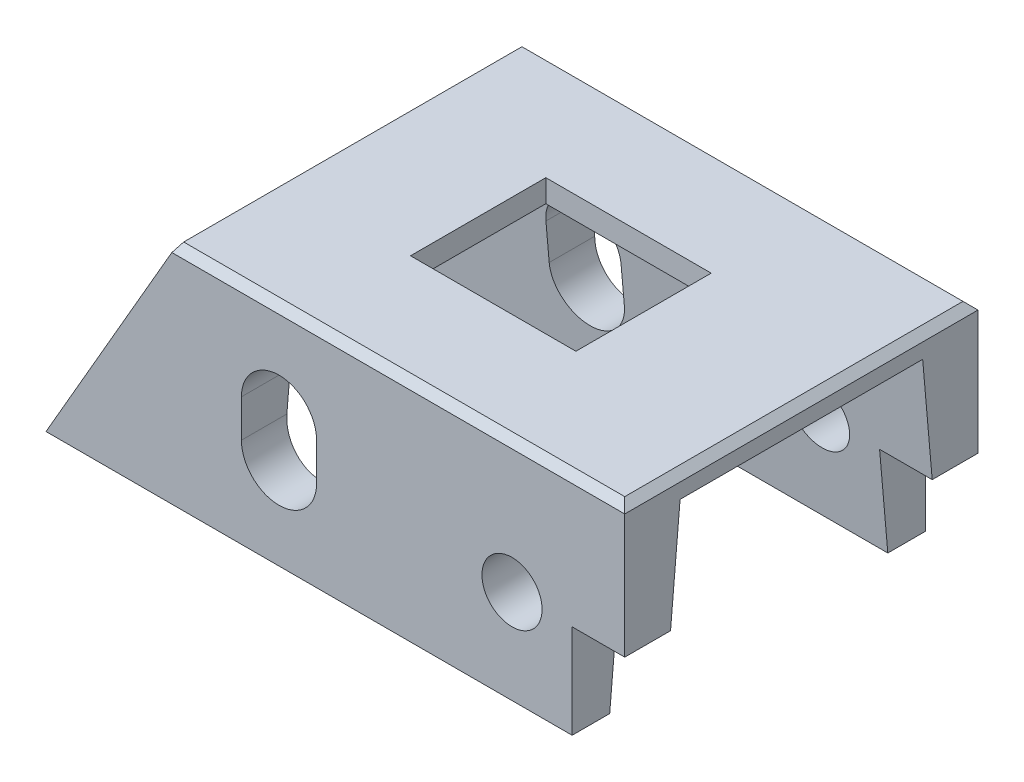
from build123d import *

# Parameters (mm, degrees)
SKETCH1_R           = 4
BOSS_EXTRUDE1_DEPTH = 23.5
CUT_EXTRUDE1_REACH  = 87.914
CUT_EXTRUDE2_REACH  = 58.712
SKETCH3_W           = 22
SKETCH3_H           = 18
CHAMFER1_SIZE       = 1


with BuildPart() as part:
    # Sketch1 → Boss-Extrude1 (new, symmetric)
    with BuildSketch(Plane.XY):
        Polygon((-35, 0), (35, 0), (35, 12.5), (42, 12.5), (42, 30), (-17.679491924, 30), align=None)
        with Locations((27, 12.5)):
            Circle(SKETCH1_R, mode=Mode.SUBTRACT)
        with BuildLine():
            Line((-9, 12), (-9, 17))
            ThreePointArc((-9, 17), (-4, 22), (1, 17))
            Line((1, 17), (1, 12))
            ThreePointArc((1, 12), (-4, 7), (-9, 12))
        make_face(mode=Mode.SUBTRACT)
    extrude(amount=BOSS_EXTRUDE1_DEPTH, both=True)

    # Sketch2 → Cut-Extrude1 (cut, up to next)
    with BuildSketch(Plane(origin=(42, 0, 0), x_dir=(0, 0, -1), z_dir=(1, 0, 0)), mode=Mode.PRIVATE) as cut_extrude1_sk1:
        Polygon((-18.5, 0), (18.5, 0), (16.137806085, 27), (-16.137806085, 27), align=None)
    cut_extrude1_tool1 = extrude(cut_extrude1_sk1.sketch, amount=-CUT_EXTRUDE1_REACH, mode=Mode.PRIVATE) & part.part
    add(cut_extrude1_tool1.solids().sort_by_distance((42, 13.193114, 0))[0], mode=Mode.SUBTRACT)

    # Sketch3 → Cut-Extrude2 (cut, up to next)
    with BuildSketch(Plane(origin=(0, 30, 0), x_dir=(1, 0, 0), z_dir=(0, 1, 0)), mode=Mode.PRIVATE) as cut_extrude2_sk1:
        with Locations((10, 0)):
            Rectangle(SKETCH3_W, SKETCH3_H)
    cut_extrude2_tool1 = extrude(cut_extrude2_sk1.sketch, amount=-CUT_EXTRUDE2_REACH, mode=Mode.PRIVATE) & part.part
    add(cut_extrude2_tool1.solids().sort_by_distance((10, 30, 0))[0], mode=Mode.SUBTRACT)

    # Chamfer1
    chamfer1_edges = [part.edges().sort_by_distance(p)[0] for p in [
        (42, 30, 0),
        (12.160254038, 30, 23.5),
        (12.160254038, 30, -23.5),
    ]]
    chamfer(chamfer1_edges, length=CHAMFER1_SIZE)


solid = part.part
